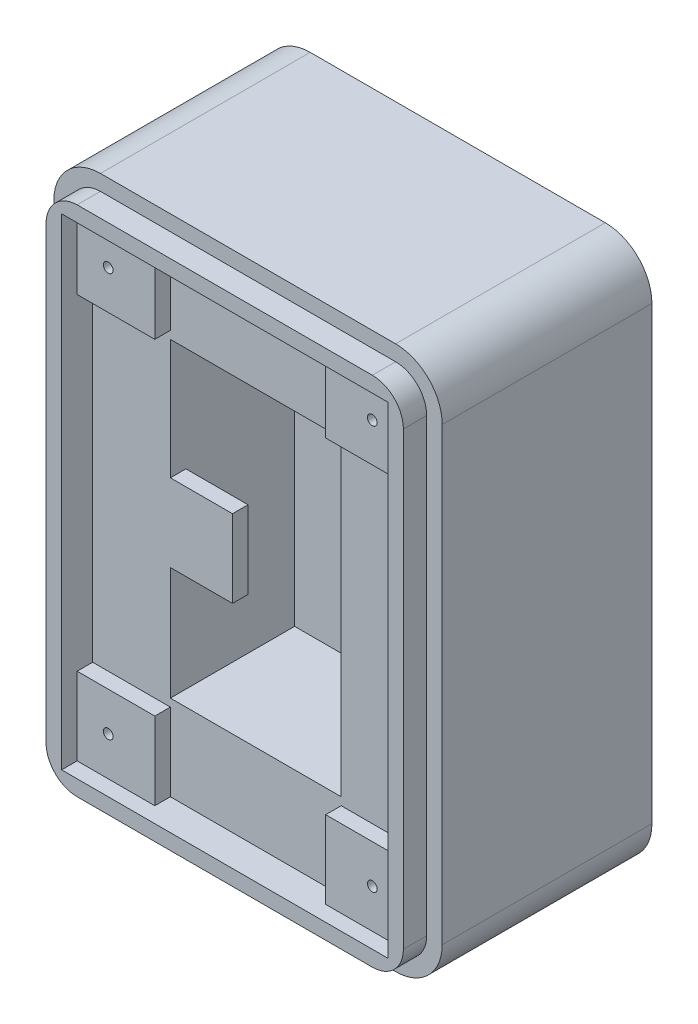
from build123d import *

# Parameters (mm, degrees)
SKETCH1_W           = 63.5
SKETCH1_H           = 88.9
BOSS_EXTRUDE1_DEPTH = 38.1
SKETCH2_W           = 27.94
SKETCH2_H           = 50.8
CUT_EXTRUDE1_DEPTH  = 25.4
SKETCH3_W           = 53.34
SKETCH3_H           = 78.74
CUT_EXTRUDE2_DEPTH  = 5.08
SKETCH4_W           = 2.54
SKETCH4_H           = 12.7
BOSS_EXTRUDE2_DEPTH = 10.16
SKETCH5_W           = 12.7
SKETCH5_H           = 12.7
BOSS_EXTRUDE3_DEPTH = 2.54
SKETCH7_R           = 0.79375
CUT_EXTRUDE3_DEPTH  = 3.81
FILLET1_R           = 7.62
CUT_EXTRUDE4_DEPTH  = 3.81


with BuildPart() as part:
    # Sketch1 → Boss-Extrude1 (new body)
    with BuildSketch(Plane.XY):
        with Locations((31.75, -44.45)):
            Rectangle(SKETCH1_W, SKETCH1_H)
    extrude(amount=BOSS_EXTRUDE1_DEPTH)

    # Sketch2 → Cut-Extrude1 (cut)
    with BuildSketch(Plane.XY.offset(38.1)):
        with Locations((31.75, -44.45)):
            Rectangle(SKETCH2_W, SKETCH2_H)
    extrude(amount=-CUT_EXTRUDE1_DEPTH, mode=Mode.SUBTRACT)

    # Sketch3 → Cut-Extrude2 (cut)
    with BuildSketch(Plane.XY.offset(38.1)):
        with Locations((31.75, -44.45)):
            Rectangle(SKETCH3_W, SKETCH3_H)
    extrude(amount=-CUT_EXTRUDE2_DEPTH, mode=Mode.SUBTRACT)

    # Sketch4 → Boss-Extrude2 (add)
    with BuildSketch(Plane(origin=(17.78, 0, 0), x_dir=(0, 0, -1), z_dir=(1, 0, 0))):
        with Locations((-31.75, -45.007977767)):
            Rectangle(SKETCH4_W, SKETCH4_H)
    extrude(amount=BOSS_EXTRUDE2_DEPTH)

    # Sketch5 → Boss-Extrude3 (add)
    with BuildSketch(Plane.XY.offset(33.02)):
        with Locations((11.43, -11.43)):
            Rectangle(SKETCH5_W, SKETCH5_H)
        with Locations((52.07, -11.43)):
            Rectangle(SKETCH5_W, SKETCH5_H)
        with Locations((11.43, -77.47)):
            Rectangle(SKETCH5_W, SKETCH5_H)
        with Locations((52.07, -77.47)):
            Rectangle(SKETCH5_W, SKETCH5_H)
    extrude(amount=BOSS_EXTRUDE3_DEPTH)

    # Sketch7 → Cut-Extrude3 (cut)
    with BuildSketch(Plane.XY.offset(35.56)):
        with Locations((10.16, -11.43)):
            Circle(SKETCH7_R)
        with Locations((53.34, -11.43)):
            Circle(SKETCH7_R)
        with Locations((10.16, -77.449583408)):
            Circle(SKETCH7_R)
        with Locations((53.34, -77.449583408)):
            Circle(SKETCH7_R)
    extrude(amount=-CUT_EXTRUDE3_DEPTH, mode=Mode.SUBTRACT)

    # Fillet1
    fillet1_edges = [part.edges().sort_by_distance(p)[0] for p in [
        (0, 0, 19.05),
        (63.5, 0, 19.05),
        (63.5, -88.9, 19.05),
        (0, -88.9, 19.05),
    ]]
    fillet(fillet1_edges, radius=FILLET1_R)

    # Sketch8 → Cut-Extrude4 (cut)
    with BuildSketch(Plane.XY.offset(38.1)):
        with BuildLine():
            ThreePointArc((0, -81.28), (2.231846327, -86.668153673), (7.62, -88.9))
            Line((7.62, -88.9), (55.88, -88.9))
            ThreePointArc((55.88, -88.9), (61.268153673, -86.668153673), (63.5, -81.28))
            Line((63.5, -81.28), (63.5, -7.62))
            ThreePointArc((63.5, -7.62), (61.268153673, -2.231846327), (55.88, 0))
            Line((55.88, 0), (7.62, 0))
            ThreePointArc((7.62, 0), (2.231846327, -2.231846327), (0, -7.62))
            Line((0, -7.62), (0, -81.28))
        make_face()
        with BuildLine():
            ThreePointArc((7.62, -2.54), (3.984072808, -4.133699841), (2.54, -7.831604579))
            Line((2.54, -7.831604579), (2.54, -81.28))
            ThreePointArc((2.54, -81.28), (4.027897552, -84.872102448), (7.62, -86.36))
            Line((7.62, -86.36), (55.88, -86.36))
            ThreePointArc((55.88, -86.36), (59.472102448, -84.872102448), (60.96, -81.28))
            Line((60.96, -81.28), (60.96, -7.62))
            ThreePointArc((60.96, -7.62), (59.472102448, -4.027897552), (55.88, -2.54))
            Line((55.88, -2.54), (7.62, -2.54))
        make_face(mode=Mode.SUBTRACT)
    extrude(amount=-CUT_EXTRUDE4_DEPTH, mode=Mode.SUBTRACT)


solid = part.part
